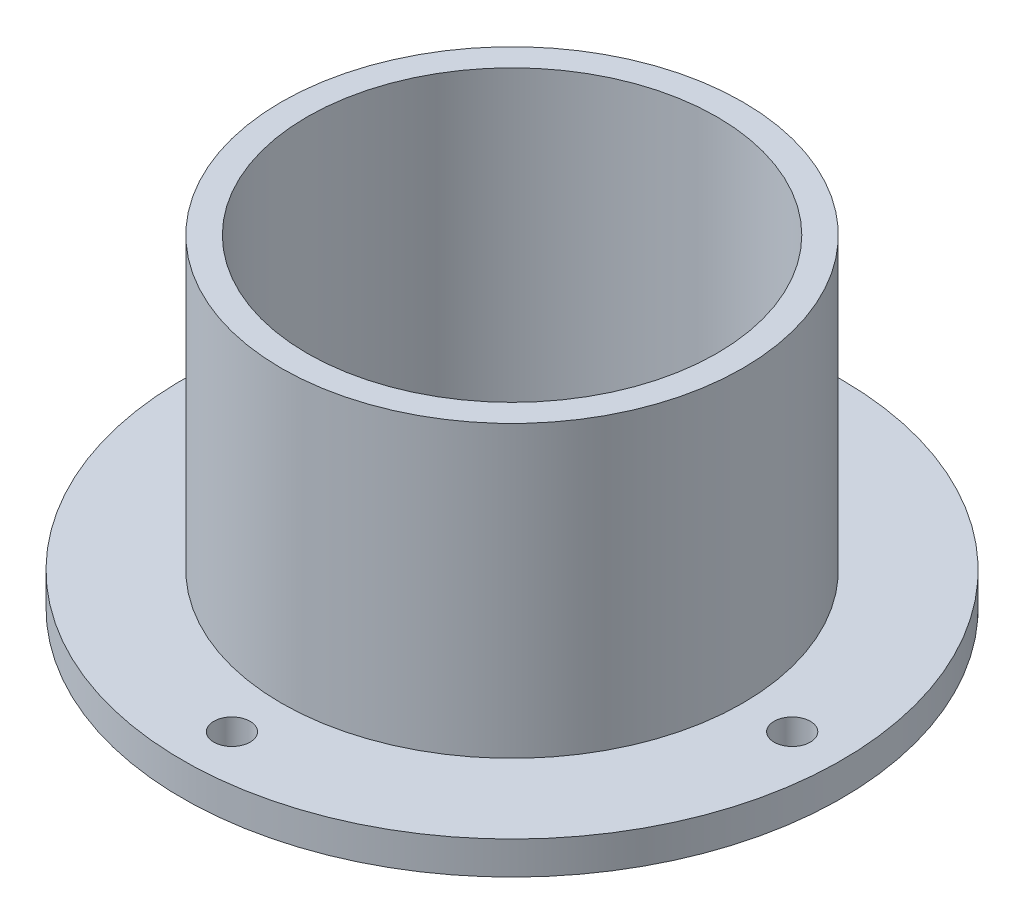
from build123d import *

# Parameters (mm, degrees)
SKETCH1_R           = 35
BOSS_EXTRUDE1_DEPTH = 9
SKETCH4_R           = 31.083201595
CUT_EXTRUDE1_DEPTH  = 9
BOSS_EXTRUDE3_START = 40
SKETCH5_R           = 35
SKETCH5_R_2         = 31.083201595
BOSS_EXTRUDE3_DEPTH = 40
SKETCH8_R           = 50
BOSS_EXTRUDE4_DEPTH = 5
SKETCH10_R          = 2.75
CUT_EXTRUDE2_DEPTH  = 5
CUT_EXTRUDE3_START  = -5
SKETCH11_R          = 31.083201595
CUT_EXTRUDE3_DEPTH  = 5


with BuildPart() as part:
    # Sketch1 → Boss-Extrude1 (new body)
    with BuildSketch(Plane(origin=(0, 0, 0), x_dir=(1, 0, 0), z_dir=(0, 1, 0))):
        with Locations(Location((0, 0, 0), (0, 0, 270))):
            Circle(SKETCH1_R)
    extrude(amount=BOSS_EXTRUDE1_DEPTH)

    # Sketch4 → Cut-Extrude1 (cut)
    with BuildSketch(Plane.XZ):
        with Locations(Location((0, 0, 0), (0, 0, 270))):
            Circle(SKETCH4_R)
    extrude(amount=-CUT_EXTRUDE1_DEPTH, mode=Mode.SUBTRACT)

    # Sketch5 → Boss-Extrude3 (add)
    with BuildSketch(Plane.XZ.offset(BOSS_EXTRUDE3_START)):
        with Locations(Location((0, 0, 0), (0, 0, 270))):
            Circle(SKETCH5_R)
        with Locations(Location((0, 0, 0), (0, 0, 270))):
            Circle(SKETCH5_R_2, mode=Mode.SUBTRACT)
    extrude(amount=-BOSS_EXTRUDE3_DEPTH)

    # Sketch8 → Boss-Extrude4 (add)
    with BuildSketch(Plane.XZ.offset(40)):
        with Locations(Location((0, 0, 0), (0, 0, 270))):
            Circle(SKETCH8_R)
    extrude(amount=-BOSS_EXTRUDE4_DEPTH)

    # Sketch10 → Cut-Extrude2 (cut)
    with BuildSketch(Plane(origin=(0, -35, 0), x_dir=(1, 0, 0), z_dir=(0, 1, 0))):
        with Locations(Location((0, 42.5, 0), (0, 0, 270))):
            Circle(SKETCH10_R)
        with Locations(Location((42.5, 0, 0), (0, 0, 270))):
            Circle(SKETCH10_R)
        with Locations(Location((0, -42.5, 0), (0, 0, 270))):
            Circle(SKETCH10_R)
        with Locations(Location((-42.5, 0, 0), (0, 0, 270))):
            Circle(SKETCH10_R)
    extrude(amount=-CUT_EXTRUDE2_DEPTH, mode=Mode.SUBTRACT)

    # Sketch11 → Cut-Extrude3 (cut)
    with BuildSketch(Plane(origin=(0, -35, 0), x_dir=(1, 0, 0), z_dir=(0, 1, 0)).offset(CUT_EXTRUDE3_START)):
        with Locations(Location((0, 0, 0), (0, 0, 90))):
            Circle(SKETCH11_R)
    extrude(amount=CUT_EXTRUDE3_DEPTH, mode=Mode.SUBTRACT)


solid = part.part
